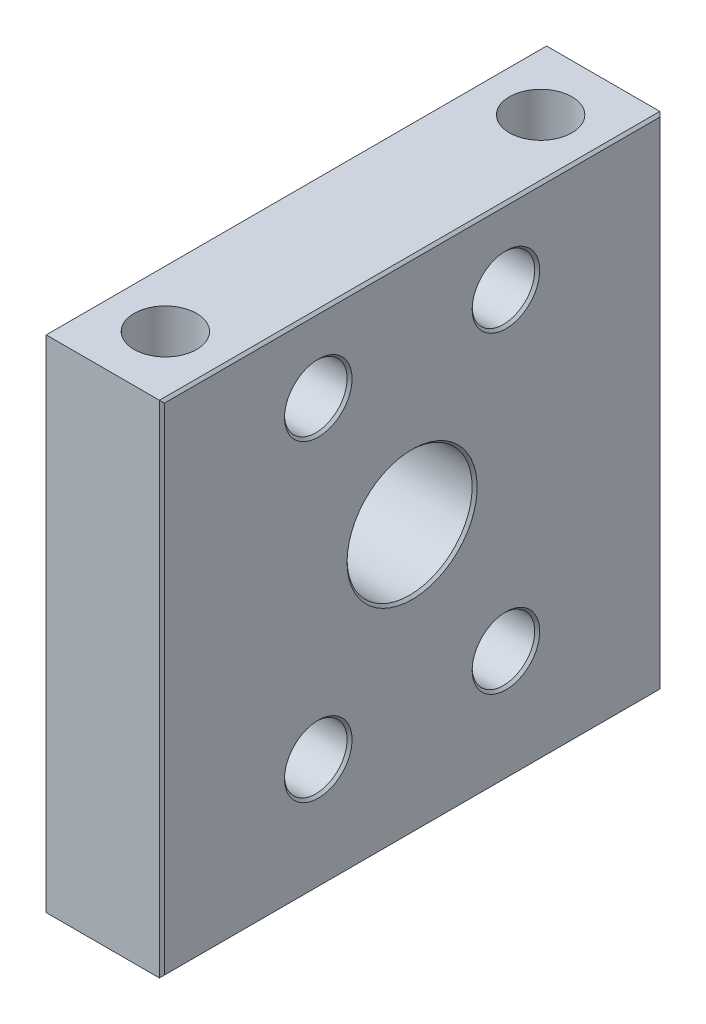
from build123d import *

# Parameters (mm, degrees)
SKETCH1_W           = 12.001902846
SKETCH1_H           = 50.8
SKETCH1_R           = 3.175
BOSS_EXTRUDE1_DEPTH = 50.8
SKETCH2_R           = 3.175
SKETCH2_R_2         = 6.35
CUT_EXTRUDE1_DEPTH  = 50.8
CHAMFER1_SIZE       = 0.254


with BuildPart() as part:
    # Sketch1 → Boss-Extrude1 (new body)
    with BuildSketch(Plane(origin=(0, 0, 0), x_dir=(1, 0, 0), z_dir=(0, 1, 0))):
        Rectangle(SKETCH1_W, SKETCH1_H)
        with Locations(Location((0, 19.05, 0), (0, 0, 270))):
            Circle(SKETCH1_R, mode=Mode.SUBTRACT)
        with Locations(Location((0, -19.05, 0), (0, 0, 270))):
            Circle(SKETCH1_R, mode=Mode.SUBTRACT)
    extrude(amount=BOSS_EXTRUDE1_DEPTH)

    # Sketch2 → Cut-Extrude1 (cut)
    with BuildSketch(Plane(origin=(6.000951423, 0, 0), x_dir=(0, 0, -1), z_dir=(1, 0, 0))):
        with Locations((-9.525, 43.18)):
            Circle(SKETCH2_R)
        with Locations((9.525, 43.18)):
            Circle(SKETCH2_R)
        with Locations((0, 27.305)):
            Circle(SKETCH2_R_2)
        with Locations((-9.525, 11.43)):
            Circle(SKETCH2_R)
        with Locations((9.525, 11.43)):
            Circle(SKETCH2_R)
    extrude(amount=-CUT_EXTRUDE1_DEPTH, mode=Mode.SUBTRACT)

    # Chamfer1
    chamfer1_edges = [part.edges().sort_by_distance(p)[0] for p in [
        (6.000951423, 50.8, 0),
        (-6.000951423, 11.43, -6.35),
        (6.000951423, 11.43, -6.35),
        (-6.000951423, 11.43, 12.7),
        (6.000951423, 11.43, 12.7),
        (-6.000951423, 27.305, 6.35),
        (6.000951423, 27.305, 6.35),
        (-6.000951423, 43.18, -6.35),
        (6.000951423, 43.18, -6.35),
        (-6.000951423, 43.18, 12.7),
        (6.000951423, 43.18, 12.7),
        (-6.000951423, 50.8, 0),
        (6.000951423, 0, 0),
        (-6.000951423, 0, 0),
        (-6.000951423, 25.4, -25.4),
        (6.000951423, 25.4, -25.4),
        (6.000951423, 25.4, 25.4),
        (-6.000951423, 25.4, 25.4),
    ]]
    chamfer(chamfer1_edges, length=CHAMFER1_SIZE)


solid = part.part
